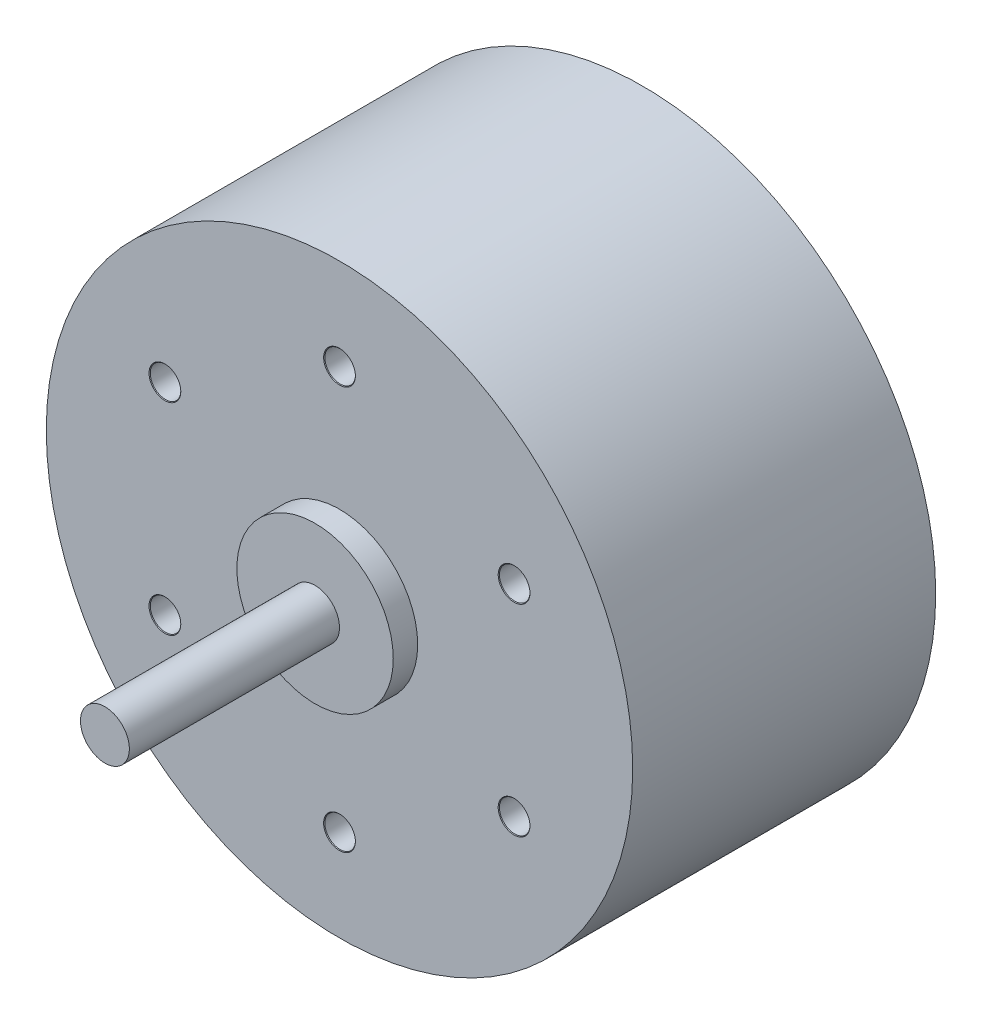
from build123d import *

# Parameters (mm, degrees)
SKETCH_2_R                     = 12
EXTRUDE_2_DEPTH                = 12.4
SKETCH_5_R                     = 3.2
EXTRUDE_4_DEPTH                = 1
SKETCH_3_R                     = 1
EXTRUDE_3_DEPTH                = 8.6
SKETCH_6_R                     = 3
EXTRUDE_5_DEPTH                = 0.7
HOLE_WIZARD_M1_6_1_D           = 1.25
HOLE_WIZARD_M1_6_1_DEPTH       = 2
HOLE_WIZARD_M1_6_1_CSINK_D     = 1.3
HOLE_WIZARD_M1_6_1_CSINK_ANGLE = 90
HOLE_WIZARD_M1_6_1_TIP         = 0.375537887


with BuildPart() as part:
    # 草圖2 → 填料-伸長2 (new body)
    with BuildSketch(Plane(origin=(0, 0, 0), x_dir=(-1, 0, 0), z_dir=(0, 0, -1))):
        with Locations(Location((0, 0, 0), (0, 0, 180))):
            Circle(SKETCH_2_R)
    extrude(amount=EXTRUDE_2_DEPTH)

    # 草圖5 → 填料-伸長4 (add)
    with BuildSketch(Plane.XY):
        Circle(SKETCH_5_R)
    extrude(amount=EXTRUDE_4_DEPTH)

    # 草圖3 → 填料-伸長3 (add)
    with BuildSketch(Plane.XY.offset(1)):
        with Locations(Location((0, 0, 0), (0, 0, 180))):
            Circle(SKETCH_3_R)
    extrude(amount=EXTRUDE_3_DEPTH)

    # 草圖6 → 填料-伸長5 (add)
    with BuildSketch(Plane(origin=(0, 0, -12.4), x_dir=(-1, 0, 0), z_dir=(0, 0, -1))):
        Circle(SKETCH_6_R)
    extrude(amount=EXTRUDE_5_DEPTH)

    # M1.6  螺絲攻的螺孔鑽1
    with Locations(Plane.XY):
        with Locations((0, 8.25), (7.144709581, 4.125), (7.144709581, -4.125), (0, -8.25), (-7.144709581, -4.125), (-7.144709581, 4.125)):
            CounterSinkHole(HOLE_WIZARD_M1_6_1_D / 2, HOLE_WIZARD_M1_6_1_CSINK_D / 2, depth=HOLE_WIZARD_M1_6_1_DEPTH, counter_sink_angle=HOLE_WIZARD_M1_6_1_CSINK_ANGLE)
            with Locations((0, 0, -(HOLE_WIZARD_M1_6_1_DEPTH + HOLE_WIZARD_M1_6_1_TIP / 2))):  # 118° drill point
                Cone(0, HOLE_WIZARD_M1_6_1_D / 2, HOLE_WIZARD_M1_6_1_TIP, mode=Mode.SUBTRACT)


solid = part.part
